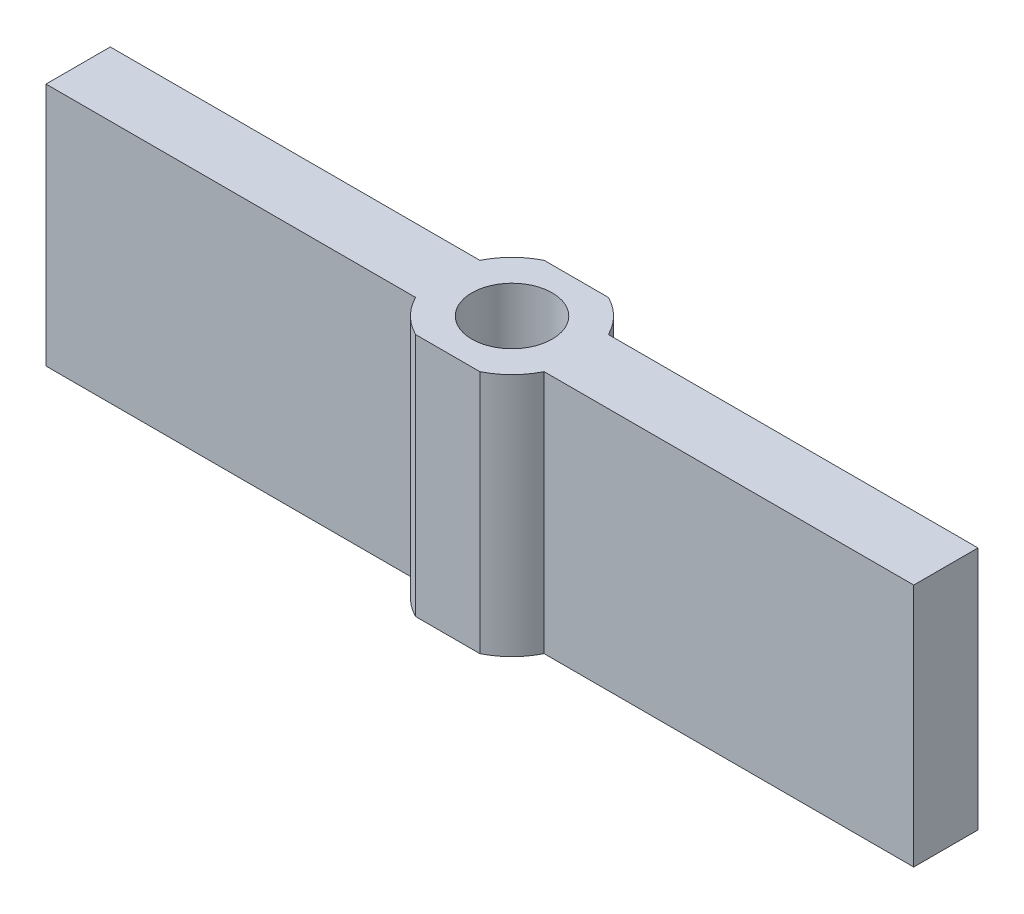
from build123d import *

# Parameters (mm, degrees)
SKETCH1_W                = 11.5
SKETCH1_H                = 7.6
BOSS_EXTRUDE5_DEPTH      = 1
BOSS_EXTRUDE5_2_DEPTH    = 1
SKETCH1_5_W              = 11.5
SKETCH1_5_H              = 7.6
BOSS_EXTRUDE6_DEPTH      = 1
BOSS_EXTRUDE7_DEPTH      = 2
BOSS_EXTRUDE7_DEPTH_BACK = 2
SKETCH1_6_W              = 4
SKETCH1_6_H              = 7.6
SKETCH2_R                = 1.25
CUT_EXTRUDE1_DEPTH       = 9


with BuildPart() as part:
    # Sketch1 → Boss-Extrude5 (new body)
    with BuildSketch(Plane.XY):
        with Locations((5.75, 3.8)):
            Rectangle(SKETCH1_W, SKETCH1_H)
    extrude(amount=BOSS_EXTRUDE5_DEPTH)



with BuildPart() as body_2:
    # Sketch1 → Boss-Extrude5 2 (new body)
    with BuildSketch(Plane.XY):
        with Locations((21.25, 3.8)):
            Rectangle(SKETCH1_W, SKETCH1_H)
    extrude(amount=BOSS_EXTRUDE5_2_DEPTH)


with BuildPart() as part_1:
    add(part.part)

    add(body_2.part)  # Boss-Extrude6 merges body 2
    # Sketch1<5> → Boss-Extrude6 (add)
    with BuildSketch(Plane.XY):
        with Locations((5.75, 3.8)):
            Rectangle(SKETCH1_5_W, SKETCH1_5_H)
        with Locations((21.25, 3.8)):
            Rectangle(SKETCH1_5_W, SKETCH1_5_H)
    extrude(amount=-BOSS_EXTRUDE6_DEPTH)

    # Sketch1<6> → Boss-Extrude7 (add, two sides: drawn at the far end of the back side and taken through both)
    with BuildSketch(Plane.XY.offset(-BOSS_EXTRUDE7_DEPTH_BACK)):
        with Locations((13.5, 3.8)):
            Rectangle(SKETCH1_6_W, SKETCH1_6_H)
    extrude(amount=BOSS_EXTRUDE7_DEPTH + BOSS_EXTRUDE7_DEPTH_BACK)

    # Sketch2 → Cut-Extrude1 (cut)
    with BuildSketch(Plane(origin=(0, 7.6, 0), x_dir=(1, 0, 0), z_dir=(0, 1, 0))):
        with BuildLine():
            Line((12.5, 2), (11.5, 2))
            Line((11.5, 2), (11.5, 1))
            ThreePointArc((11.5, 1), (11.91886117, 1.58113883), (12.5, 2))
        make_face()
        with BuildLine():
            Line((15.5, 2), (14.5, 2))
            ThreePointArc((14.5, 2), (15.08113883, 1.58113883), (15.5, 1))
            Line((15.5, 1), (15.5, 2))
        make_face()
        with BuildLine():
            ThreePointArc((12.5, -2), (11.91886117, -1.58113883), (11.5, -1))
            Line((11.5, -1), (11.5, -2))
            Line((11.5, -2), (12.5, -2))
        make_face()
        with BuildLine():
            Line((15.5, -2), (15.5, -1))
            ThreePointArc((15.5, -1), (15.08113883, -1.58113883), (14.5, -2))
            Line((14.5, -2), (15.5, -2))
        make_face()
        with Locations((13.5, 0)):
            Circle(SKETCH2_R)
    extrude(amount=-CUT_EXTRUDE1_DEPTH, mode=Mode.SUBTRACT)


solid = part_1.part
